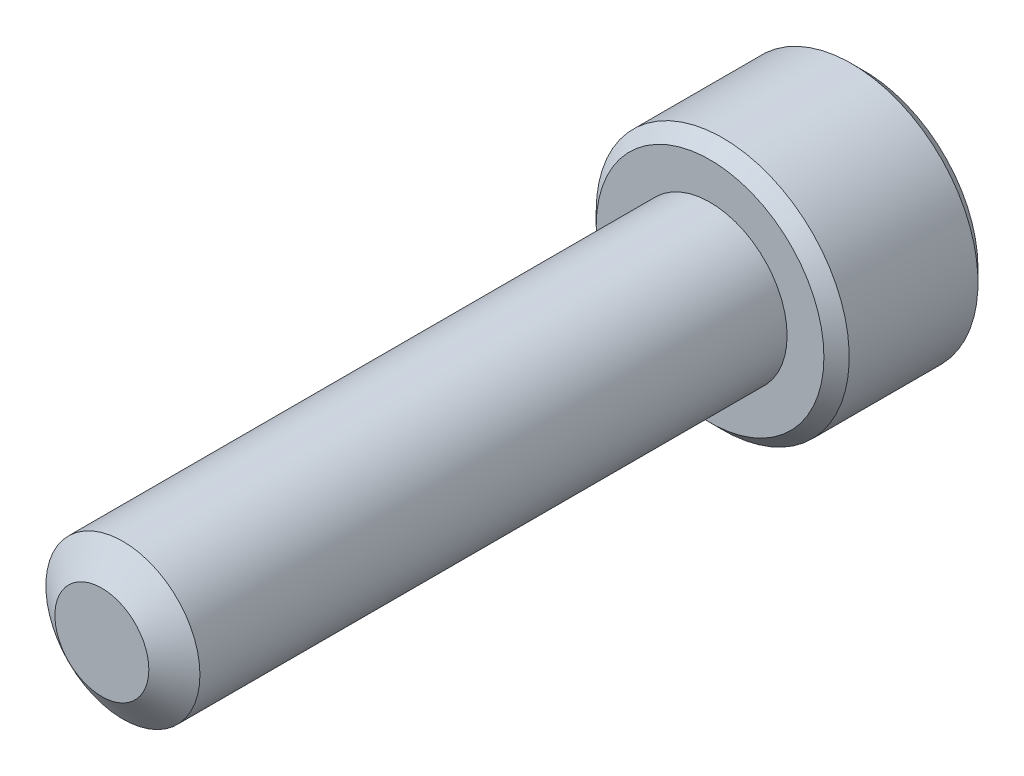
from build123d import *

# Parameters (mm, degrees)
SKETCH1_R          = 2.413
EXTRUDE1_DEPTH     = 19.05
SKETCH6_R          = 3.9624
EXTRUDE2_DEPTH     = 4.826
CUT_EXTRUDE1_DEPTH = 2.9765625
CHAMFER1_SIZE      = 0.39624


with BuildPart() as part:
    # Sketch1 → Extrude1 (new body)
    with BuildSketch(Plane.XY):
        Circle(SKETCH1_R)
    extrude(amount=-EXTRUDE1_DEPTH)

    # Sketch4 → Cut-Revolve1 (revolve, cut)
    with BuildSketch(Plane(origin=(0, 0, 0), x_dir=(0, 0, -1), z_dir=(1, 0, 0))):
        Polygon((0.659180743, 2.413), (0, 1.471592336), (0, 2.413), align=None)
    revolve(axis=Axis((0, 0, 0), (0, 0, -1)), mode=Mode.SUBTRACT)

    # Sketch6 → Extrude2 (add)
    with BuildSketch(Plane(origin=(0, 0, -19.05), x_dir=(-1, 0, 0), z_dir=(0, 0, -1))):
        Circle(SKETCH6_R)
    extrude(amount=EXTRUDE2_DEPTH)

    # Sketch7 → Cut-Extrude1 (cut)
    with BuildSketch(Plane(origin=(0, 0, -23.876), x_dir=(-1, 0, 0), z_dir=(0, 0, -1))):
        Polygon((0, 2.291358881), (-1.984375, 1.14567944), (-1.984375, -1.14567944), (0, -2.291358881), (1.984375, -1.14567944), (1.984375, 1.14567944), align=None)
    extrude(amount=-CUT_EXTRUDE1_DEPTH, mode=Mode.SUBTRACT)

    # Cut-Extrude2 cone 1 section (through the dimple's axis) → Cut-Extrude2 (revolve, cut)
    with BuildSketch(Plane(origin=(0, 0, -23.876), x_dir=(0, 1, 0), z_dir=(1, 0, 0))):
        Polygon((0, 0), (2.291358881, 0), (0, 2.291358881), align=None)
    revolve(axis=Axis((0, 0, -23.876), (0, 0, 1)), mode=Mode.SUBTRACT)

    # Chamfer1
    chamfer1_edges = [part.edges().sort_by_distance(p)[0] for p in [
        (3.9624, 0, -23.876),
        (3.9624, 0, -19.05),
    ]]
    chamfer(chamfer1_edges, length=CHAMFER1_SIZE)


solid = part.part
